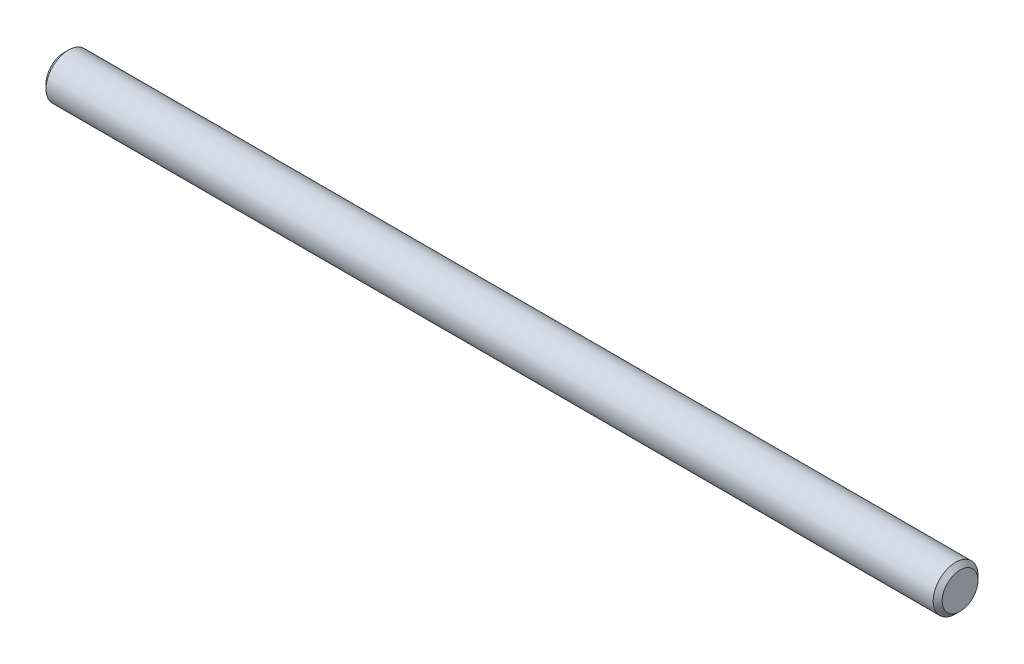
from build123d import *

# Parameters (mm, degrees)
EXTRUDE1_DEPTH      = 7.9375
EXTRUDE1_DEPTH_BACK = 7.9375
SKETCH2_R           = 0.396875
CHAMFER1_SIZE       = 0.079375


with BuildPart() as part:
    # Sketch2 → Extrude1 (new, two sides: drawn at the far end of the back side and taken through both)
    with BuildSketch(Plane(origin=(0, 0, 0), x_dir=(0, 0, -1), z_dir=(1, 0, 0)).offset(-EXTRUDE1_DEPTH_BACK)):
        Circle(SKETCH2_R)
    extrude(amount=EXTRUDE1_DEPTH + EXTRUDE1_DEPTH_BACK)

    # Chamfer1
    chamfer1_edges = [part.edges().sort_by_distance(p)[0] for p in [
        (-7.9375, 0, 0.396875),
        (7.9375, 0, 0.396875),
    ]]
    chamfer(chamfer1_edges, length=CHAMFER1_SIZE)


solid = part.part
